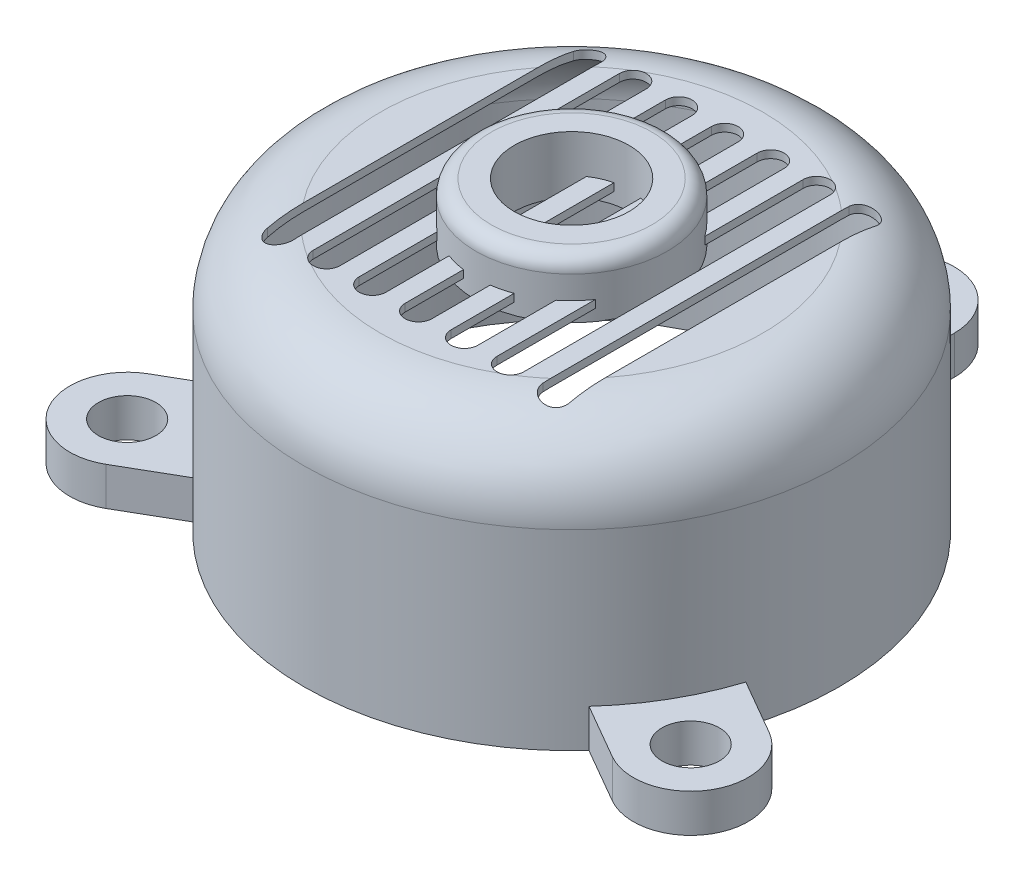
from build123d import *

# Parameters (mm, degrees)
BOSS_EXTRUDE1_START      = -88.9
SKETCH3_R                = 9.525
BOSS_EXTRUDE1_DEPTH      = 12.7
CUT_EXTRUDE1_DEPTH       = 192.564312773
BOSS_EXTRUDE2_DEPTH      = 12.7
BOSS_EXTRUDE2_DEPTH_BACK = 6.35
SKETCH5_R                = 31.75
SKETCH5_R_2              = 19.05
FILLET1_R                = 5.08


with BuildPart() as part:
    # Sketch2 → Revolve-Thin1 (revolve)
    with BuildSketch(Plane.XY, mode=Mode.PRIVATE) as revolve_thin1_sk:
        with BuildLine():
            Line((0, 88.9), (63.5, 88.9))
            ThreePointArc((63.5, 88.9), (81.460512242, 81.460512242), (88.9, 63.5))
            Line((88.9, 63.5), (88.9, 0))
            Line((88.9, 0), (86.36, 0))
            Line((86.36, 0), (86.36, 63.5))
            ThreePointArc((86.36, 63.5), (79.664461018, 79.664461018), (63.5, 86.36))
            Line((63.5, 86.36), (0, 86.36))
            Line((0, 86.36), (0, 88.9))
        make_face()
    revolve(revolve_thin1_sk.sketch.rotate(Axis((0, 0, 0), (0, 1, 0)), 90), axis=Axis((0, 0, 0), (0, 1, 0)))

    # Sketch3 → Boss-Extrude1 (add)
    # profile 1 of 3: a face of its own
    with BuildSketch(Plane(origin=(0, 88.9, 0), x_dir=(1, 0, 0), z_dir=(0, 1, 0)).offset(BOSS_EXTRUDE1_START)):
        with BuildLine():
            Line((-19.05, 107.95), (-19.05, 86.834944003))
            ThreePointArc((-19.05, 86.834944003), (0, 88.9), (19.05, 86.834944003))
            Line((19.05, 86.834944003), (19.05, 107.95))
            ThreePointArc((19.05, 107.95), (0, 127), (-19.05, 107.95))
        make_face()
        with Locations(Location((0, 107.95, 0), (0, 0, 270))):
            Circle(SKETCH3_R, mode=Mode.SUBTRACT)
    # profile 2 of 3: a face of its own
    with BuildSketch(Plane(origin=(0, 88.9, 0), x_dir=(1, 0, 0), z_dir=(0, 1, 0)).offset(BOSS_EXTRUDE1_START)):
        with BuildLine():
            ThreePointArc((-65.676267443, -59.915255944), (-76.989658396, -44.45), (-84.726267443, -26.919688059))
            Line((-84.726267443, -26.919688059), (-103.012442339, -37.477216058))
            ThreePointArc((-103.012442339, -37.477216058), (-109.985226281, -63.5), (-83.962442339, -70.472783942))
            Line((-83.962442339, -70.472783942), (-65.676267443, -59.915255944))
        make_face()
        with Locations(Location((-93.487442339, -53.975, 0), (0, 0, 270))):
            Circle(SKETCH3_R, mode=Mode.SUBTRACT)
    # profile 3 of 3: a face of its own
    with BuildSketch(Plane(origin=(0, 88.9, 0), x_dir=(1, 0, 0), z_dir=(0, 1, 0)).offset(BOSS_EXTRUDE1_START)):
        with BuildLine():
            Line((103.012442339, -37.477216058), (84.726267443, -26.919688059))
            ThreePointArc((84.726267443, -26.919688059), (76.989658396, -44.45), (65.676267443, -59.915255944))
            Line((65.676267443, -59.915255944), (83.962442339, -70.472783942))
            ThreePointArc((83.962442339, -70.472783942), (109.985226281, -63.5), (103.012442339, -37.477216058))
        make_face()
        with Locations(Location((93.487442339, -53.975, 0), (0, 0, 270))):
            Circle(SKETCH3_R, mode=Mode.SUBTRACT)
    extrude(amount=BOSS_EXTRUDE1_DEPTH)

    # Sketch4 → Cut-Extrude1 (cut, through all)
    with BuildSketch(Plane(origin=(0, 88.9, 0), x_dir=(1, 0, 0), z_dir=(0, 1, 0))):
        with BuildLine():
            Line((-50.165, -50.8), (-50.165, 50.8))
            ThreePointArc((-50.165, 50.8), (-45.72, 55.245), (-41.275, 50.8))
            Line((-41.275, 50.8), (-41.275, -50.8))
            ThreePointArc((-41.275, -50.8), (-45.72, -55.245), (-50.165, -50.8))
        make_face()
        with BuildLine():
            Line((-34.925, -50.8), (-34.925, 50.8))
            ThreePointArc((-34.925, 50.8), (-30.48, 55.245), (-26.035, 50.8))
            Line((-26.035, 50.8), (-26.035, -50.8))
            ThreePointArc((-26.035, -50.8), (-30.48, -55.245), (-34.925, -50.8))
        make_face()
        with BuildLine():
            Line((-19.685, -50.8), (-19.685, 50.8))
            ThreePointArc((-19.685, 50.8), (-15.24, 55.245), (-10.795, 50.8))
            Line((-10.795, 50.8), (-10.795, -50.8))
            ThreePointArc((-10.795, -50.8), (-15.24, -55.245), (-19.685, -50.8))
        make_face()
        with BuildLine():
            Line((-4.445, -50.8), (-4.445, 50.8))
            ThreePointArc((-4.445, 50.8), (0, 55.245), (4.445, 50.8))
            Line((4.445, 50.8), (4.445, -50.8))
            ThreePointArc((4.445, -50.8), (0, -55.245), (-4.445, -50.8))
        make_face()
        with BuildLine():
            Line((10.795, -50.8), (10.795, 50.8))
            ThreePointArc((10.795, 50.8), (15.24, 55.245), (19.685, 50.8))
            Line((19.685, 50.8), (19.685, -50.8))
            ThreePointArc((19.685, -50.8), (15.24, -55.245), (10.795, -50.8))
        make_face()
        with BuildLine():
            Line((26.035, -50.8), (26.035, 50.8))
            ThreePointArc((26.035, 50.8), (30.48, 55.245), (34.925, 50.8))
            Line((34.925, 50.8), (34.925, -50.8))
            ThreePointArc((34.925, -50.8), (30.48, -55.245), (26.035, -50.8))
        make_face()
        with BuildLine():
            Line((41.275, -50.8), (41.275, 50.8))
            ThreePointArc((41.275, 50.8), (45.72, 55.245), (50.165, 50.8))
            Line((50.165, 50.8), (50.165, -50.8))
            ThreePointArc((50.165, -50.8), (45.72, -55.245), (41.275, -50.8))
        make_face()
    extrude(amount=-CUT_EXTRUDE1_DEPTH, mode=Mode.SUBTRACT)

    # Sketch5 → Boss-Extrude2 (add, two sides: drawn at the far end of the back side and taken through both)
    with BuildSketch(Plane(origin=(0, 88.9, 0), x_dir=(1, 0, 0), z_dir=(0, 1, 0)).offset(-BOSS_EXTRUDE2_DEPTH_BACK)):
        with Locations(Location((0, 0, 0), (0, 0, 270))):
            Circle(SKETCH5_R)
        with Locations(Location((0, 0, 0), (0, 0, 270))):
            Circle(SKETCH5_R_2, mode=Mode.SUBTRACT)
    extrude(amount=BOSS_EXTRUDE2_DEPTH + BOSS_EXTRUDE2_DEPTH_BACK)

    # Fillet1
    fillet1_edges = [part.edges().sort_by_distance(p)[0] for p in [
        (0, 101.6, -31.75),
    ]]
    fillet(fillet1_edges, radius=FILLET1_R)


solid = part.part
